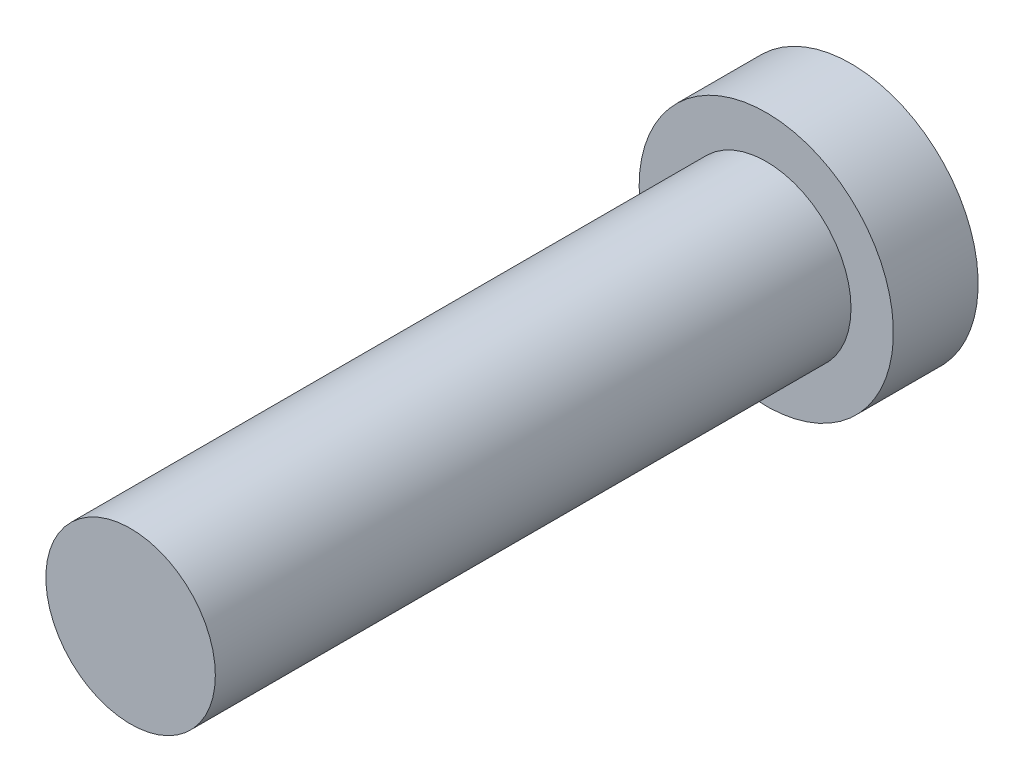
from build123d import *

# Parameters (mm, degrees)
SKETCH1_R           = 10
BOSS_EXTRUDE1_DEPTH = 75
SKETCH2_R           = 15
BOSS_EXTRUDE2_DEPTH = 10


with BuildPart() as part:
    # Sketch1 → Boss-Extrude1 (new body)
    with BuildSketch(Plane.XY):
        Circle(SKETCH1_R)
    extrude(amount=BOSS_EXTRUDE1_DEPTH)

    # Sketch2 → Boss-Extrude2 (add)
    with BuildSketch(Plane(origin=(0, 0, 0), x_dir=(-1, 0, 0), z_dir=(0, 0, -1))):
        Circle(SKETCH2_R)
    extrude(amount=BOSS_EXTRUDE2_DEPTH)


solid = part.part
